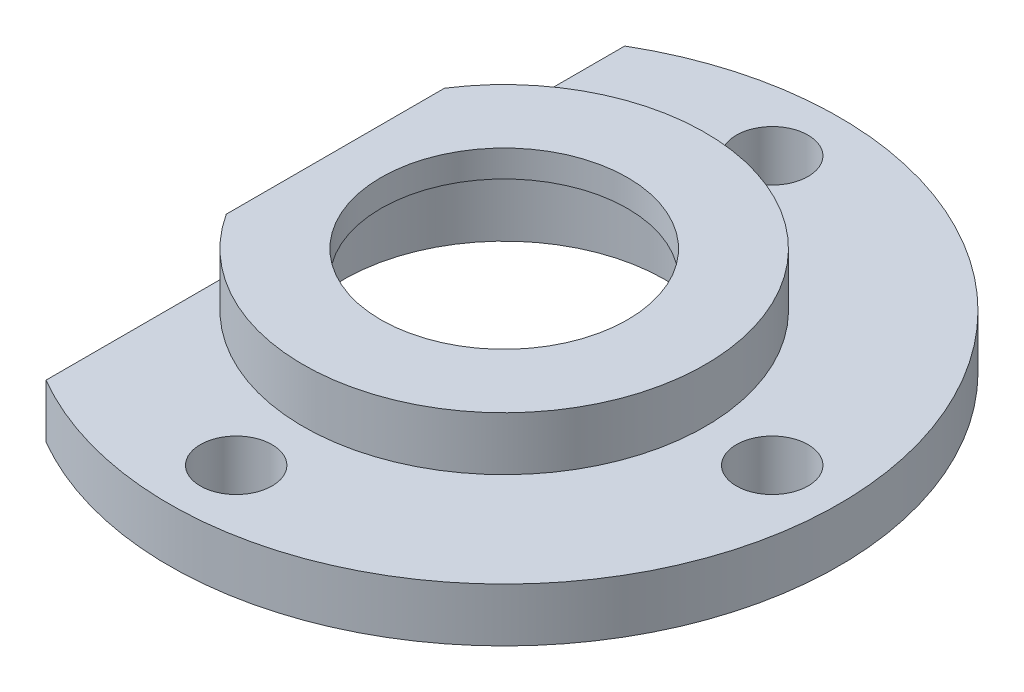
from build123d import *

# Parameters (mm, degrees)
SKETCH1_R                      = 15.875
BOSS_EXTRUDE1_DEPTH            = 2.54
SKETCH2_R                      = 9.525
BOSS_EXTRUDE2_DEPTH            = 2.54
SKETCH3_R                      = 7.62
CUT_EXTRUDE1_DEPTH             = 3.81
CUT_EXTRUDE2_REACH             = 25.018
SKETCH4_R                      = 5.842
CUT_EXTRUDE3_REACH             = 24.594
SKETCH5_R                      = 1.7
CUT_EXTRUDE5_REACH             = 24.594
CUT_EXTRUDE5_DIRECTION_2_DEPTH = 2.794


with BuildPart() as part:
    # Sketch1 → Boss-Extrude1 (new body)
    with BuildSketch(Plane(origin=(0, 0, 0), x_dir=(1, 0, 0), z_dir=(0, 1, 0))):
        with Locations(Location((0, 0, 0), (0, 0, 270))):
            Circle(SKETCH1_R)
    extrude(amount=BOSS_EXTRUDE1_DEPTH)

    # Sketch2 → Boss-Extrude2 (add)
    with BuildSketch(Plane(origin=(0, 2.54, 0), x_dir=(1, 0, 0), z_dir=(0, 1, 0))):
        with Locations(Location((0, 0, 0), (0, 0, 270))):
            Circle(SKETCH2_R)
    extrude(amount=BOSS_EXTRUDE2_DEPTH)

    # Sketch3 → Cut-Extrude1 (cut)
    with BuildSketch(Plane.XZ):
        with Locations(Location((0, 0, 0), (0, 0, 270))):
            Circle(SKETCH3_R)
    extrude(amount=-CUT_EXTRUDE1_DEPTH, mode=Mode.SUBTRACT)

    # Sketch4 → Cut-Extrude2 (cut, up to next)
    with BuildSketch(Plane(origin=(0, 5.08, 0), x_dir=(1, 0, 0), z_dir=(0, 1, 0)), mode=Mode.PRIVATE) as cut_extrude2_sk1:
        with Locations(Location((0, 0, 0), (0, 0, 270))):
            Circle(SKETCH4_R)
    cut_extrude2_tool1 = extrude(cut_extrude2_sk1.sketch, amount=-CUT_EXTRUDE2_REACH, mode=Mode.PRIVATE) & part.part
    add(cut_extrude2_tool1.solids().sort_by_distance((0, 5.08, 0))[0], mode=Mode.SUBTRACT)

    # Sketch5 → Cut-Extrude3 (cut, up to next)
    with BuildSketch(Plane(origin=(0, 2.54, 0), x_dir=(1, 0, 0), z_dir=(0, 1, 0)), mode=Mode.PRIVATE) as cut_extrude3_sk1:
        with Locations(Location((0, 12.7, 0), (0, 0, 270))):
            Circle(SKETCH5_R)
    cut_extrude3_tool1 = extrude(cut_extrude3_sk1.sketch, amount=-CUT_EXTRUDE3_REACH, mode=Mode.PRIVATE) & part.part
    # Sketch5 → Cut-Extrude3 (cut, up to next)
    with BuildSketch(Plane(origin=(0, 2.54, 0), x_dir=(1, 0, 0), z_dir=(0, 1, 0)), mode=Mode.PRIVATE) as cut_extrude3_sk2:
        with Locations(Location((12.7, 0, 0), (0, 0, 270))):
            Circle(SKETCH5_R)
    cut_extrude3_tool2 = extrude(cut_extrude3_sk2.sketch, amount=-CUT_EXTRUDE3_REACH, mode=Mode.PRIVATE) & part.part
    # Sketch5 → Cut-Extrude3 (cut, up to next)
    with BuildSketch(Plane(origin=(0, 2.54, 0), x_dir=(1, 0, 0), z_dir=(0, 1, 0)), mode=Mode.PRIVATE) as cut_extrude3_sk3:
        with Locations(Location((0, -12.7, 0), (0, 0, 270))):
            Circle(SKETCH5_R)
    cut_extrude3_tool3 = extrude(cut_extrude3_sk3.sketch, amount=-CUT_EXTRUDE3_REACH, mode=Mode.PRIVATE) & part.part
    # Sketch5 → Cut-Extrude3 (cut, up to next)
    with BuildSketch(Plane(origin=(0, 2.54, 0), x_dir=(1, 0, 0), z_dir=(0, 1, 0)), mode=Mode.PRIVATE) as cut_extrude3_sk4:
        with Locations(Location((-12.7, 0, 0), (0, 0, 270))):
            Circle(SKETCH5_R)
    cut_extrude3_tool4 = extrude(cut_extrude3_sk4.sketch, amount=-CUT_EXTRUDE3_REACH, mode=Mode.PRIVATE) & part.part
    add(cut_extrude3_tool1.solids().sort_by_distance((0, 2.54, -12.7))[0], mode=Mode.SUBTRACT)
    add(cut_extrude3_tool2.solids().sort_by_distance((12.7, 2.54, 0))[0], mode=Mode.SUBTRACT)
    add(cut_extrude3_tool3.solids().sort_by_distance((0, 2.54, 12.7))[0], mode=Mode.SUBTRACT)
    add(cut_extrude3_tool4.solids().sort_by_distance((-12.7, 2.54, 0))[0], mode=Mode.SUBTRACT)

    # Sketch6 → Cut-Extrude5 (cut, up to next)
    with BuildSketch(Plane(origin=(0, 2.54, 0), x_dir=(1, 0, 0), z_dir=(0, 1, 0)), mode=Mode.PRIVATE) as cut_extrude5_sk1:
        with BuildLine():
            Line((-8, -13.711878974), (-8, 13.711878974))
            ThreePointArc((-8, 13.711878974), (-15.875, 0), (-8, -13.711878974))
        make_face()
    cut_extrude5_tool1 = extrude(cut_extrude5_sk1.sketch, amount=-CUT_EXTRUDE5_REACH, mode=Mode.PRIVATE) & part.part
    add(cut_extrude5_tool1.solids().sort_by_distance((-11.228338, 2.54, 0))[0], mode=Mode.SUBTRACT)

    # Sketch6 → Cut-Extrude5 direction 2 (cut)
    with BuildSketch(Plane(origin=(0, 2.54, 0), x_dir=(1, 0, 0), z_dir=(0, 1, 0))):
        with BuildLine():
            Line((-8, -13.711878974), (-8, 13.711878974))
            ThreePointArc((-8, 13.711878974), (-15.875, 0), (-8, -13.711878974))
        make_face()
    extrude(amount=CUT_EXTRUDE5_DIRECTION_2_DEPTH, mode=Mode.SUBTRACT)


solid = part.part
